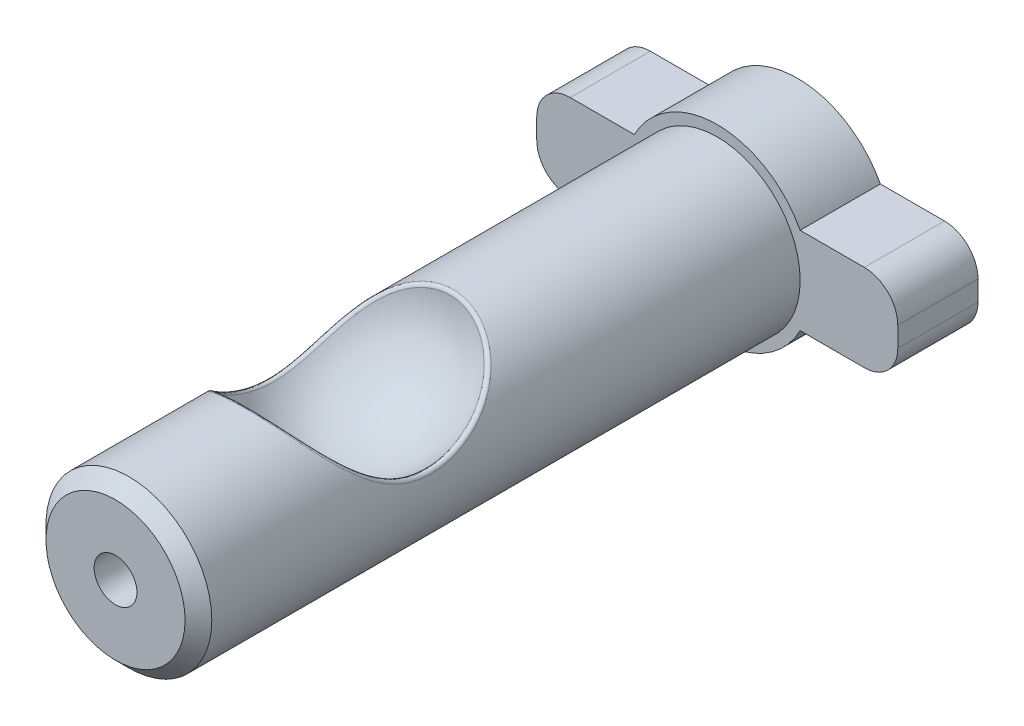
from build123d import *

# Parameters (mm, degrees)
BOSS_EXTRU_1_DEPTH   = 12
BOSS_EXTRU_3_START   = 12
ESQUISSE2_R          = 12.4
BOSS_EXTRU_3_DEPTH   = 90
CHANFREIN2_SIZE      = 2
CONG_1_R             = 0.5
D_GAGEMENT_M61_D     = 6.4
D_GAGEMENT_M61_DEPTH = 12
D_GAGEMENT_M61_TIP   = 1.922753981


with BuildPart() as part:
    # Esquisse1 → Boss.-Extru.1 (new body)
    with BuildSketch(Plane.XY):
        with BuildLine():
            Line((12.399596768, 6.5), (22, 6.5))
            ThreePointArc((22, 6.5), (25.535533906, 5.035533906), (27, 1.5))
            Line((27, 1.5), (27, -1.5))
            ThreePointArc((27, -1.5), (25.535533906, -5.035533906), (22, -6.5))
            Line((22, -6.5), (12.399596768, -6.5))
            ThreePointArc((12.399596768, -6.5), (0, -14), (-12.399596768, -6.5))
            Line((-12.399596768, -6.5), (-22, -6.5))
            ThreePointArc((-22, -6.5), (-25.535533906, -5.035533906), (-27, -1.5))
            Line((-27, -1.5), (-27, 1.5))
            ThreePointArc((-27, 1.5), (-25.535533906, 5.035533906), (-22, 6.5))
            Line((-22, 6.5), (-12.399596768, 6.5))
            ThreePointArc((-12.399596768, 6.5), (0, 14), (12.399596768, 6.5))
        make_face()
    extrude(amount=BOSS_EXTRU_1_DEPTH)

    # Esquisse2 → Boss.-Extru.3 (add)
    with BuildSketch(Plane.XY.offset(BOSS_EXTRU_3_START)):
        with Locations(Location((0, 0, 0), (0, 0, 180))):
            Circle(ESQUISSE2_R)
    extrude(amount=BOSS_EXTRU_3_DEPTH)

    # Esquisse12 → Enlèvement de matière-Révolution20 (revolve, cut)
    with BuildSketch(Plane(origin=(0, 0, 0), x_dir=(0, 0, -1), z_dir=(1, 0, 0))):
        with BuildLine():
            Line((-52, 12.4), (-82, 12.4))
            ThreePointArc((-82, 12.4), (-67, -2.6), (-52, 12.4))
        make_face()
    revolve(axis=Axis((0, 12.4, 52), (0, 0, 1)), mode=Mode.SUBTRACT)

    # Chanfrein2
    chanfrein2_edges = [part.edges().sort_by_distance(p)[0] for p in [
        (12.4, 0, 102),
    ]]
    chamfer(chanfrein2_edges, length=CHANFREIN2_SIZE)

    # Congé1
    cong_1_edges = [part.edges().sort_by_distance(p)[0] for p in [
        (-11.945217842, 3.327419301, 66.999999771),
    ]]
    fillet(cong_1_edges, radius=CONG_1_R)

    # Dégagement M61
    with Locations(Plane.XY.offset(102)):
        with Locations((0, 0)):
            Hole(D_GAGEMENT_M61_D / 2, depth=D_GAGEMENT_M61_DEPTH)
            with Locations((0, 0, -(D_GAGEMENT_M61_DEPTH + D_GAGEMENT_M61_TIP / 2))):  # 118° drill point
                Cone(0, D_GAGEMENT_M61_D / 2, D_GAGEMENT_M61_TIP, mode=Mode.SUBTRACT)


solid = part.part
